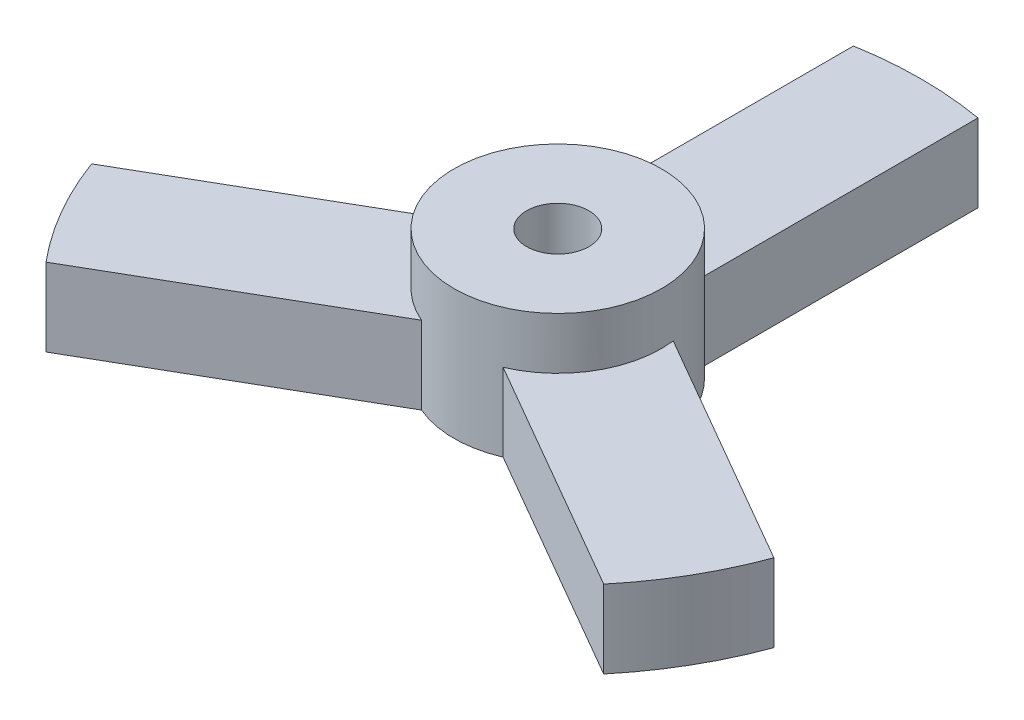
from build123d import *

# Parameters (mm, degrees)
BOSS_EXTRUDE1_DEPTH = 7.5
SKETCH2_R           = 10
BOSS_EXTRUDE2_DEPTH = 5


with BuildPart() as part:
    # Sketch1 → Boss-Extrude1 (new body)
    with BuildSketch(Plane(origin=(0, 0, 0), x_dir=(1, 0, 0), z_dir=(0, 1, 0))):
        with BuildLine():
            Line((-6, 34.481879299), (-6, 8))
            ThreePointArc((-6, 8), (-8.660254038, 5), (-9.92820323, 1.196152423))
            Line((-9.92820323, 1.196152423), (-32.862183443, -12.044787227))
            ThreePointArc((-32.862183443, -12.044787227), (-30.310889132, -17.5), (-26.862183443, -22.437092072))
            Line((-26.862183443, -22.437092072), (-3.92820323, -9.196152423))
            ThreePointArc((-3.92820323, -9.196152423), (0, -10), (3.92820323, -9.196152423))
            Line((3.92820323, -9.196152423), (26.862183443, -22.437092072))
            ThreePointArc((26.862183443, -22.437092072), (30.310889132, -17.5), (32.862183443, -12.044787227))
            Line((32.862183443, -12.044787227), (9.92820323, 1.196152423))
            ThreePointArc((9.92820323, 1.196152423), (8.660254038, 5), (6, 8))
            Line((6, 8), (6, 34.481879299))
            ThreePointArc((6, 34.481879299), (0, 35), (-6, 34.481879299))
        make_face()
    extrude(amount=BOSS_EXTRUDE1_DEPTH)

    # Sketch2 → Boss-Extrude2 (add)
    with BuildSketch(Plane(origin=(0, 7.5, 0), x_dir=(1, 0, 0), z_dir=(0, 1, 0))):
        with Locations(Location((0, 0, 0), (0, 0, 53.130102354))):
            Circle(SKETCH2_R)
    extrude(amount=BOSS_EXTRUDE2_DEPTH)

    # Sketch3 → Cut-Revolve1 (revolve, cut)
    with BuildSketch(Plane.XY):
        Polygon((0, 0), (0, 12.5), (3, 12.5), (3, 1.732050808), (6, 0), align=None)
    revolve(axis=Axis((0, 0, 0), (0, 1, 0)), mode=Mode.SUBTRACT)


solid = part.part
